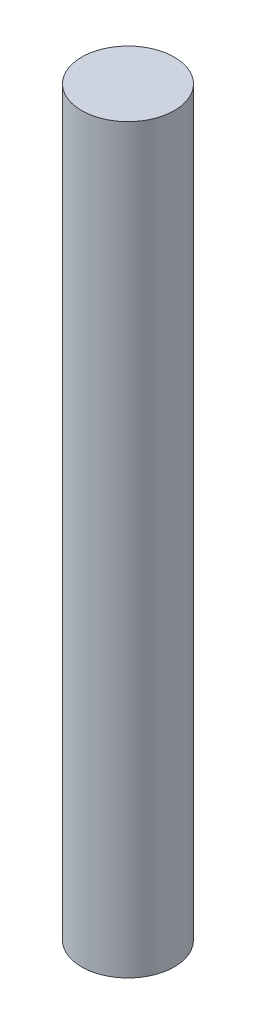
from build123d import *

# Parameters (mm, degrees)
SKETCH_1_R      = 1
EXTRUDE_1_DEPTH = 16


with BuildPart() as part:
    # 草图1 → 凸台-拉伸1 (new body)
    with BuildSketch(Plane(origin=(0, 0, 0), x_dir=(1, 0, 0), z_dir=(0, 1, 0))):
        with Locations(Location((0, 0, 0), (0, 0, 270))):
            Circle(SKETCH_1_R)
    extrude(amount=EXTRUDE_1_DEPTH)


solid = part.part
